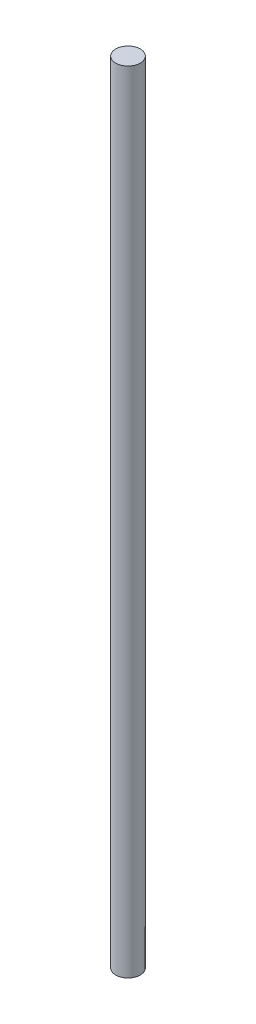
from build123d import *

# Parameters (mm, degrees)
SKETCH_1_R      = 4
EXTRUDE_1_DEPTH = 257


with BuildPart() as part:
    # 草图1 → 凸台-拉伸1 (new body)
    with BuildSketch(Plane(origin=(0, 0, 0), x_dir=(1, 0, 0), z_dir=(0, 1, 0))):
        with Locations(Location((0, 0, 0), (0, 0, 270))):
            Circle(SKETCH_1_R)
    extrude(amount=EXTRUDE_1_DEPTH)


solid = part.part
